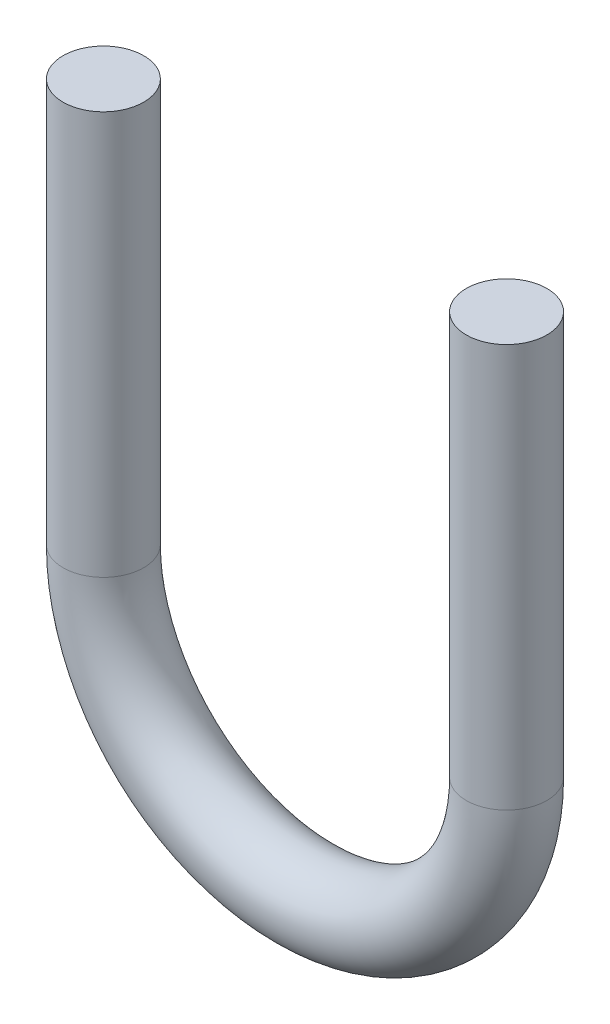
from build123d import *

# Parameters (mm, degrees)
SKETCH2_R = 3.175


with BuildPart() as part:
    # Sweep1: sweep along a path in Sketch1
    with BuildLine(Plane.XY) as sweep1_path:
        Line((-12.7, 31.75), (-12.7, 0))
        ThreePointArc((-12.7, 0), (0, -12.7), (12.7, 0))
        Line((12.7, 0), (12.7, 31.75))
    # Sketch2 → Sweep1 (sweep)
    with BuildSketch(Plane(origin=(0, 31.75, 0), x_dir=(1, 0, 0), z_dir=(0, 1, 0))):
        with Locations((-15.875, 0)):
            Circle(SKETCH2_R)
    sweep(path=sweep1_path.line)


solid = part.part
